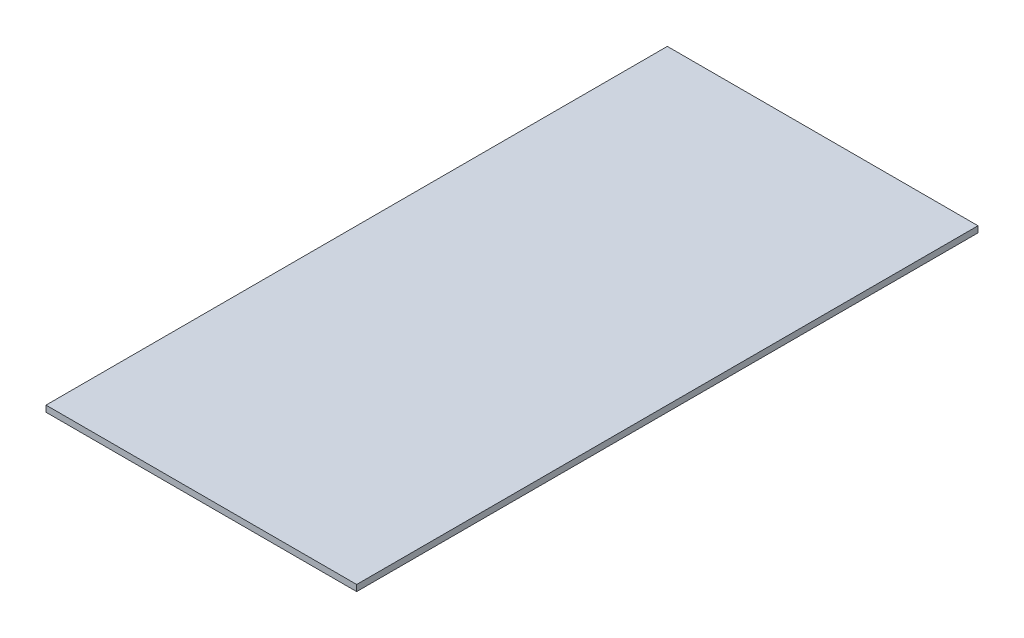
from build123d import *

# Parameters (mm, degrees)
BOSS_EXTRUDE1_DEPTH = 3.175


with BuildPart() as part:
    # Sketch1 → Boss-Extrude1 (new body)
    with BuildSketch(Plane(origin=(0, 0, 0), x_dir=(1, 0, 0), z_dir=(0, 1, 0))):
        Polygon((130.175, 0), (158.75, 0), (158.75, 317.5), (0, 317.5), (0, 0), (28.575, 0), align=None)
    extrude(amount=BOSS_EXTRUDE1_DEPTH)


solid = part.part
